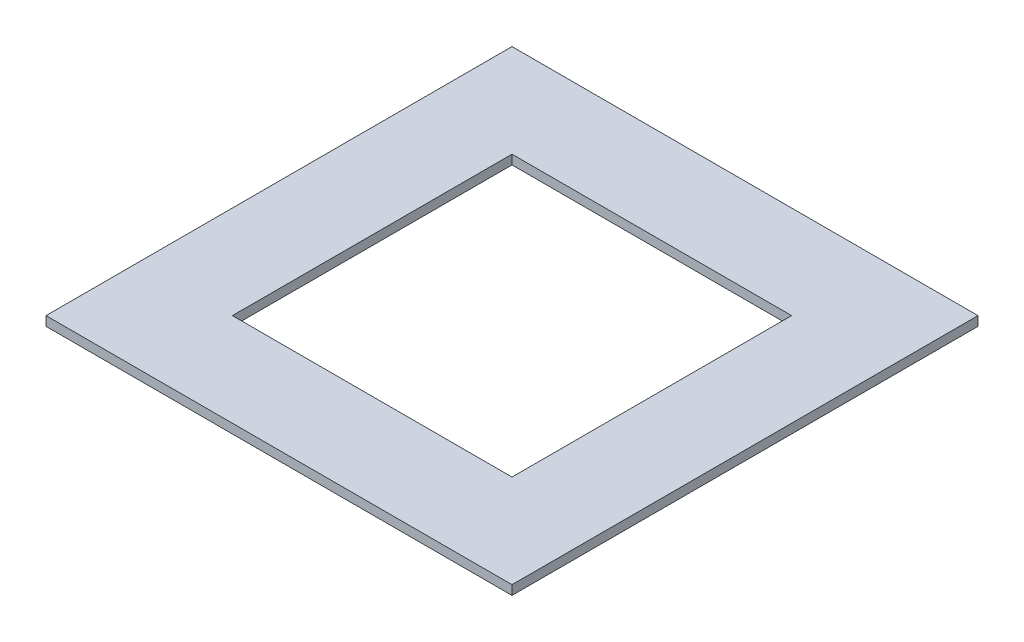
from build123d import *

# Parameters (mm, degrees)
CROQUIS1_W              = 25
CROQUIS1_H              = 25
CROQUIS1_W_2            = 15
CROQUIS1_H_2            = 15
SALIENTE_EXTRUIR1_DEPTH = 0.5


with BuildPart() as part:
    # Croquis1 → Saliente-Extruir1 (new body)
    with BuildSketch(Plane(origin=(0, 0, 0), x_dir=(1, 0, 0), z_dir=(0, 1, 0))):
        with Locations((12.5, 12.5)):
            Rectangle(CROQUIS1_W, CROQUIS1_H)
        with Locations((12.5, 12.5)):
            Rectangle(CROQUIS1_W_2, CROQUIS1_H_2, mode=Mode.SUBTRACT)
    extrude(amount=SALIENTE_EXTRUIR1_DEPTH)


solid = part.part
